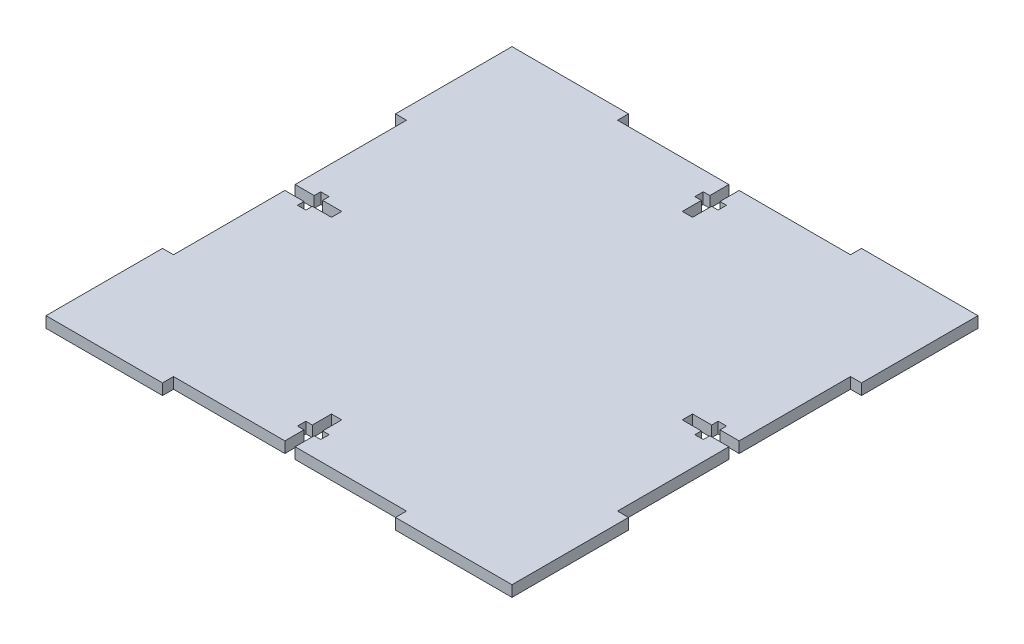
from build123d import *

# Parameters (mm, degrees)
SKETCH1_W           = 127
SKETCH1_H           = 127
BOSS_EXTRUDE1_DEPTH = 2.9972
SKETCH2_W           = 63.5
SKETCH2_H           = 2.9972
SKETCH2_W_2         = 2.9972
SKETCH2_H_2         = 63.5
CUT_EXTRUDE1_DEPTH  = 2.9972
CUT_EXTRUDE2_REACH  = 181.63


with BuildPart() as part:
    # Sketch1 → Boss-Extrude1 (new body)
    with BuildSketch(Plane(origin=(0, 0, 0), x_dir=(1, 0, 0), z_dir=(0, 1, 0))):
        with Locations((63.5, -63.5)):
            Rectangle(SKETCH1_W, SKETCH1_H)
    extrude(amount=BOSS_EXTRUDE1_DEPTH)

    # Sketch2 → Cut-Extrude1 (cut)
    with BuildSketch(Plane(origin=(0, 2.9972, 0), x_dir=(1, 0, 0), z_dir=(0, 1, 0))):
        with Locations((63.5, -125.5014)):
            Rectangle(SKETCH2_W, SKETCH2_H)
        with Locations((1.4986, -63.5)):
            Rectangle(SKETCH2_W_2, SKETCH2_H_2)
        with Locations((125.5014, -63.5)):
            Rectangle(SKETCH2_W_2, SKETCH2_H_2)
        with Locations((63.5, -1.4986)):
            Rectangle(SKETCH2_W, SKETCH2_H)
    extrude(amount=-CUT_EXTRUDE1_DEPTH, mode=Mode.SUBTRACT)

    # Sketch3 → Cut-Extrude2 (cut, up to next)
    with BuildSketch(Plane(origin=(0, 2.9972, 0), x_dir=(1, 0, 0), z_dir=(0, 1, 0)), mode=Mode.PRIVATE) as cut_extrude2_sk1:
        Polygon((2.9972, -64.897), (8.2042, -64.897), (8.2042, -66.675), (10.4902, -66.675), (10.4902, -64.897), (15.6972, -64.897), (15.6972, -62.103), (10.4902, -62.103), (10.4902, -60.325), (8.2042, -60.325), (8.2042, -62.103), (2.9972, -62.103), align=None)
    cut_extrude2_tool1 = extrude(cut_extrude2_sk1.sketch, amount=-CUT_EXTRUDE2_REACH, mode=Mode.PRIVATE) & part.part
    # Sketch3 → Cut-Extrude2 (cut, up to next)
    with BuildSketch(Plane(origin=(0, 2.9972, 0), x_dir=(1, 0, 0), z_dir=(0, 1, 0)), mode=Mode.PRIVATE) as cut_extrude2_sk2:
        Polygon((62.103, -124.0028), (64.897, -124.0028), (64.897, -118.7958), (66.675, -118.7958), (66.675, -116.5098), (64.897, -116.5098), (64.897, -111.3028), (62.103, -111.3028), (62.103, -116.5098), (60.325, -116.5098), (60.325, -118.7958), (62.103, -118.7958), align=None)
    cut_extrude2_tool2 = extrude(cut_extrude2_sk2.sketch, amount=-CUT_EXTRUDE2_REACH, mode=Mode.PRIVATE) & part.part
    # Sketch3 → Cut-Extrude2 (cut, up to next)
    with BuildSketch(Plane(origin=(0, 2.9972, 0), x_dir=(1, 0, 0), z_dir=(0, 1, 0)), mode=Mode.PRIVATE) as cut_extrude2_sk3:
        Polygon((118.7958, -66.675), (118.7958, -64.897), (124.0028, -64.897), (124.0028, -62.103), (118.7958, -62.103), (118.7958, -60.325), (116.5098, -60.325), (116.5098, -62.103), (111.3028, -62.103), (111.3028, -64.897), (116.5098, -64.897), (116.5098, -66.675), align=None)
    cut_extrude2_tool3 = extrude(cut_extrude2_sk3.sketch, amount=-CUT_EXTRUDE2_REACH, mode=Mode.PRIVATE) & part.part
    # Sketch3 → Cut-Extrude2 (cut, up to next)
    with BuildSketch(Plane(origin=(0, 2.9972, 0), x_dir=(1, 0, 0), z_dir=(0, 1, 0)), mode=Mode.PRIVATE) as cut_extrude2_sk4:
        Polygon((62.103, -2.9972), (62.103, -8.2042), (60.325, -8.2042), (60.325, -10.4902), (62.103, -10.4902), (62.103, -15.6972), (64.897, -15.6972), (64.897, -10.4902), (66.675, -10.4902), (66.675, -8.2042), (64.897, -8.2042), (64.897, -2.9972), align=None)
    cut_extrude2_tool4 = extrude(cut_extrude2_sk4.sketch, amount=-CUT_EXTRUDE2_REACH, mode=Mode.PRIVATE) & part.part
    add(cut_extrude2_tool1.solids().sort_by_distance((9.3472, 2.9972, 63.5))[0], mode=Mode.SUBTRACT)
    add(cut_extrude2_tool2.solids().sort_by_distance((63.5, 2.9972, 117.6528))[0], mode=Mode.SUBTRACT)
    add(cut_extrude2_tool3.solids().sort_by_distance((117.6528, 2.9972, 63.5))[0], mode=Mode.SUBTRACT)
    add(cut_extrude2_tool4.solids().sort_by_distance((63.5, 2.9972, 9.3472))[0], mode=Mode.SUBTRACT)


solid = part.part
